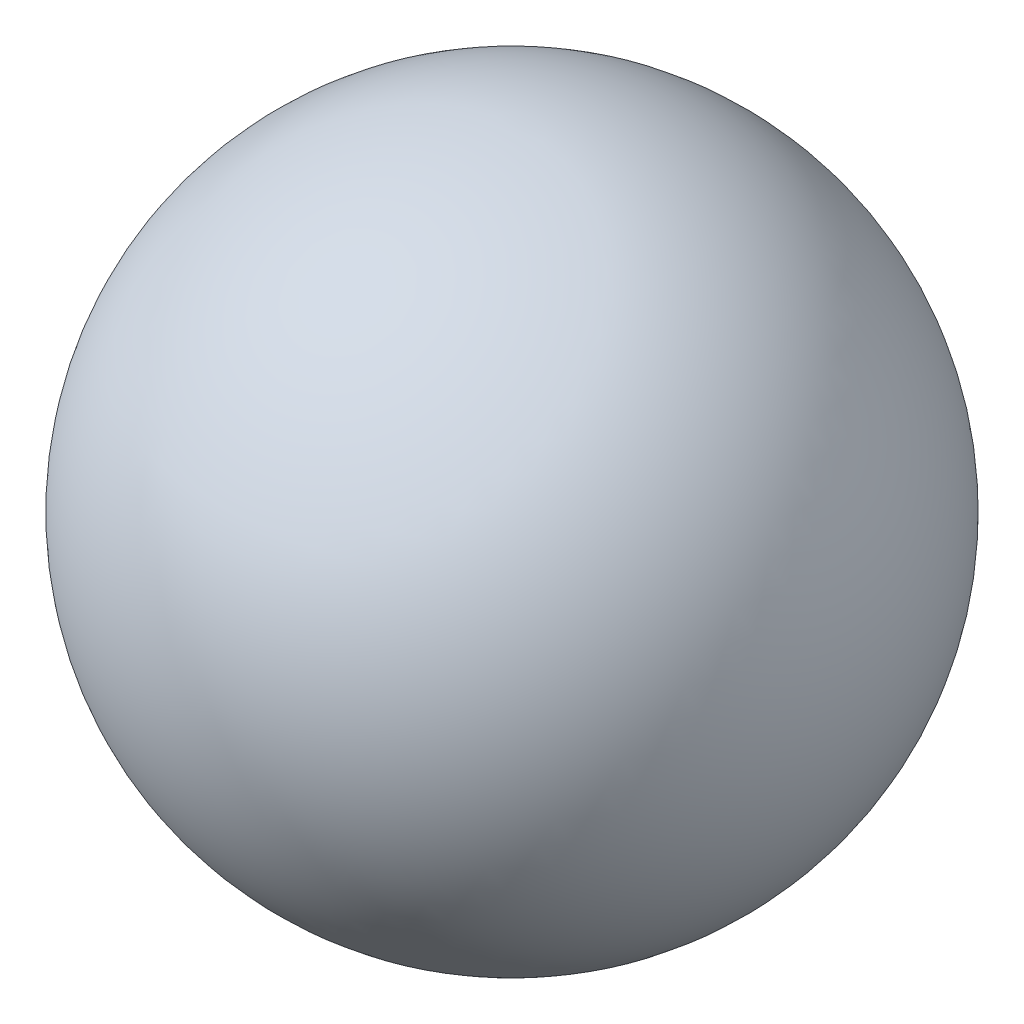
from build123d import *


with BuildPart() as part:
    # Sketch1 one side → Revolve5 (revolve)
    with BuildSketch(Plane.XY):
        with BuildLine():
            Line((0, -37.5), (0, 37.5))
            ThreePointArc((0, 37.5), (-37.5, 0), (0, -37.5))
        make_face()
    revolve(axis=Axis((0, -17.27244871, 0), (0, 1, 0)))


solid = part.part
